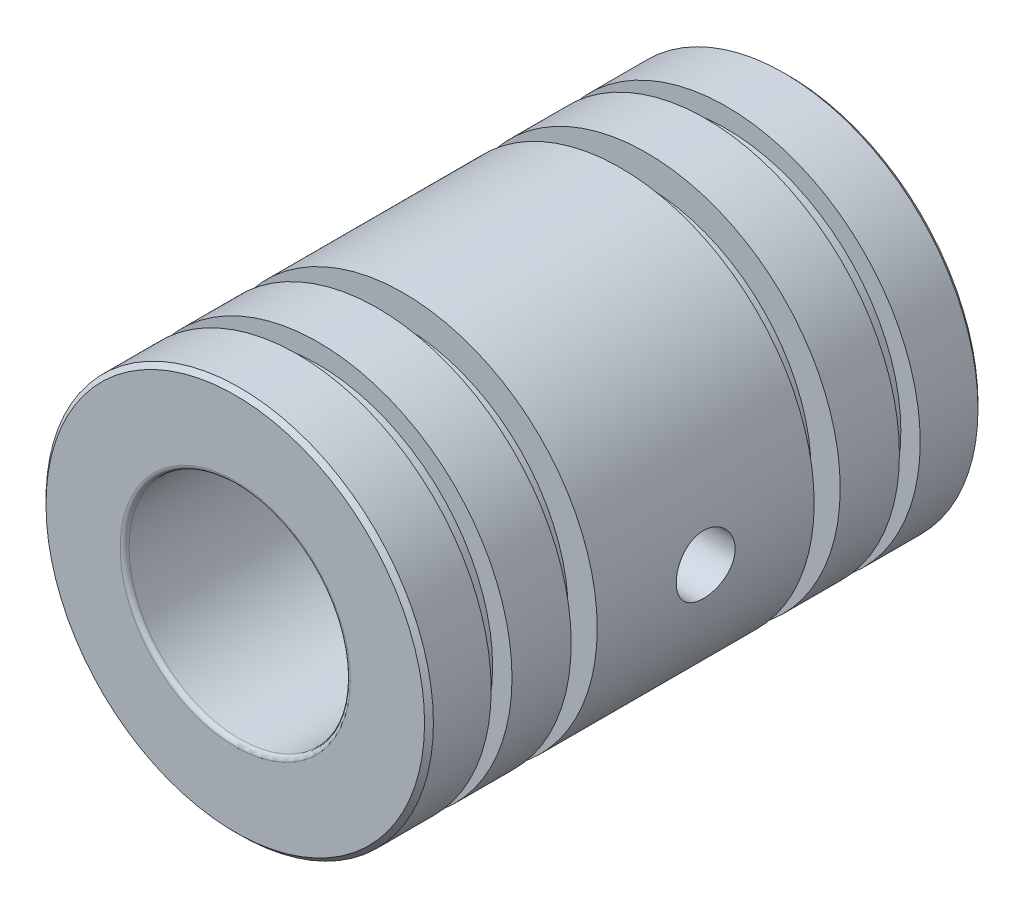
from build123d import *

# Parameters (mm, degrees)
BORE_DEPTH           = 23.338105056
BORE_DEPTH_BACK      = 23.338105056
SKETCH2_R            = 6.35
RETAINING_HOLE_2_R   = 1.6891
RETAINING_HOLE_DEPTH = 23.338105056
ID_FILLET_R          = 0.254
OD_CHAMFER_SIZE      = 0.254
O_RINGS_2_W          = 1.49225
O_RINGS_2_H          = 1.666875


with BuildPart() as part:
    # Sketch1 → Bearing (revolve)
    with BuildSketch(Plane(origin=(0, 0, 0), x_dir=(0, 0, -1), z_dir=(1, 0, 0)), mode=Mode.PRIVATE) as bearing_sk:
        Polygon((-15.875, 0), (15.875, 0), (15.875, -11.1125), (12.3063, -11.1125), (12.3063, -10.00125), (11.1125, -10.00125), (11.1125, -11.1125), (-11.1125, -11.1125), (-11.1125, -10.00125), (-12.3063, -10.00125), (-12.3063, -11.1125), (-15.875, -11.1125), align=None)
    revolve(bearing_sk.sketch.rotate(Axis((0, 0, 15.875), (0, 0, -1)), 270), axis=Axis((0, 0, 15.875), (0, 0, -1)))

    # Sketch2 → Bore (cut, two sides: drawn at the far end of the back side and taken through both)
    with BuildSketch(Plane.XY.offset(-BORE_DEPTH_BACK)):
        Circle(SKETCH2_R)
    extrude(amount=BORE_DEPTH + BORE_DEPTH_BACK, mode=Mode.SUBTRACT)

    # Retaining Hole 2 → Retaining Hole (cut, through all)
    with BuildSketch(Plane(origin=(0, 0, 0), x_dir=(0, 0, -1), z_dir=(1, 0, 0))):
        with Locations(Location((0, 0, 0), (0, 0, 180))):
            Circle(RETAINING_HOLE_2_R)
    extrude(amount=RETAINING_HOLE_DEPTH, mode=Mode.SUBTRACT)

    # ID Fillet
    id_fillet_edges = [part.edges().sort_by_distance(p)[0] for p in [
        (-6.35, 0, -15.875),
        (-6.35, 0, 15.875),
    ]]
    fillet(id_fillet_edges, radius=ID_FILLET_R)

    # OD Chamfer
    od_chamfer_edges = [part.edges().sort_by_distance(p)[0] for p in [
        (-11.1125, 0, 15.875),
        (-11.1125, 0, -15.875),
    ]]
    chamfer(od_chamfer_edges, length=OD_CHAMFER_SIZE)

    # O-Rings 2 → O-Rings (revolve, cut)
    with BuildSketch(Plane(origin=(0, 0, 0), x_dir=(0, 0, -1), z_dir=(1, 0, 0)), mode=Mode.PRIVATE) as o_rings_sk:
        with Locations((-6.969125, -10.2790625)):
            Rectangle(O_RINGS_2_W, O_RINGS_2_H)
        with Locations((6.969125, -10.2790625)):
            Rectangle(O_RINGS_2_W, O_RINGS_2_H)
    revolve(o_rings_sk.sketch.rotate(Axis((0, 0, 15.875), (0, 0, -1)), 270), axis=Axis((0, 0, 15.875), (0, 0, -1)), mode=Mode.SUBTRACT)


solid = part.part
